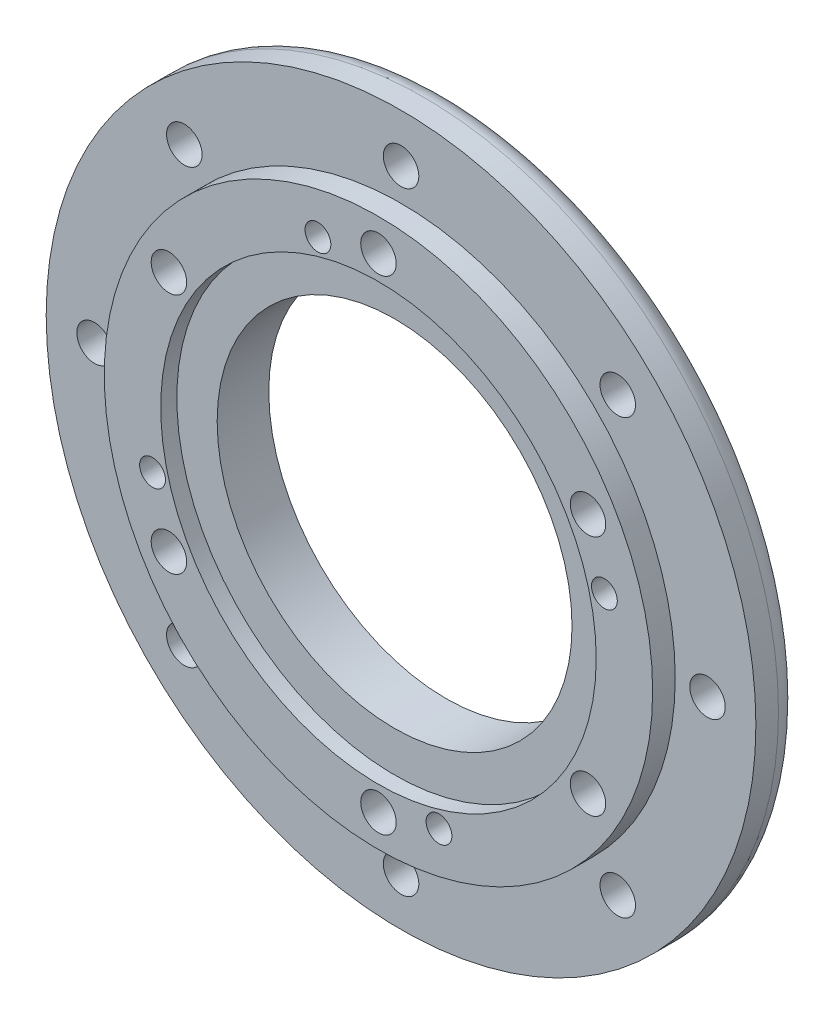
from build123d import *

# Parameters (mm, degrees)
SKETCH_1_R          = 110
EXTRUDE_1_DEPTH     = 14
SKETCH_2_R          = 85
EXTRUDE_2_DEPTH     = 7
SKETCH_3_R          = 55
CUT_EXTRUDE_1_DEPTH = 157.974520225
FILLET_1_R          = 7
SKETCH_5_R          = 5.5
CUT_EXTRUDE_2_DEPTH = 157.974520225
SKETCH_6_R          = 5.5
CUT_EXTRUDE_3_DEPTH = 157.974520225
SKETCH_7_R          = 67.5
CUT_EXTRUDE_4_DEPTH = 5
SKETCH_8_R          = 9
CUT_EXTRUDE_5_DEPTH = 11
SKETCH_10_R         = 4
CUT_EXTRUDE_6_DEPTH = 157.974520225


with BuildPart() as part:
    # 草图1 → 拉伸1 (new body)
    with BuildSketch(Plane.XY):
        Circle(SKETCH_1_R)
    extrude(amount=EXTRUDE_1_DEPTH)

    # 草图2 → 拉伸2 (add)
    with BuildSketch(Plane.XY.offset(14)):
        Circle(SKETCH_2_R)
    extrude(amount=EXTRUDE_2_DEPTH)

    # 草图3 → 切除-拉伸1 (cut, through all)
    with BuildSketch(Plane(origin=(0, 0, 0), x_dir=(-1, 0, 0), z_dir=(0, 0, -1))):
        Circle(SKETCH_3_R)
    extrude(amount=-CUT_EXTRUDE_1_DEPTH, mode=Mode.SUBTRACT)

    # 圆角1
    fillet_1_edges = [part.edges().sort_by_distance(p)[0] for p in [
        (-110, 0, 0),
    ]]
    fillet(fillet_1_edges, radius=FILLET_1_R)

    # 草图5 → 切除-拉伸2 (cut, through all)
    with BuildSketch(Plane(origin=(0, 0, 0), x_dir=(-1, 0, 0), z_dir=(0, 0, -1))):
        with Locations((0, 95)):
            Circle(SKETCH_5_R)
        with Locations((67.175144213, 67.175144213)):
            Circle(SKETCH_5_R)
        with Locations((95, 0)):
            Circle(SKETCH_5_R)
        with Locations((67.175144213, -67.175144213)):
            Circle(SKETCH_5_R)
        with Locations((0, -95)):
            Circle(SKETCH_5_R)
        with Locations((-67.175144213, -67.175144213)):
            Circle(SKETCH_5_R)
        with Locations((-95, 0)):
            Circle(SKETCH_5_R)
        with Locations((-67.175144213, 67.175144213)):
            Circle(SKETCH_5_R)
    extrude(amount=-CUT_EXTRUDE_2_DEPTH, mode=Mode.SUBTRACT)

    # 草图6 → 切除-拉伸3 (cut, through all)
    with BuildSketch(Plane(origin=(0, 0, 0), x_dir=(-1, 0, 0), z_dir=(0, 0, -1))):
        with Locations((0, 75)):
            Circle(SKETCH_6_R)
        with Locations((64.951905284, 37.5)):
            Circle(SKETCH_6_R)
        with Locations((64.951905284, -37.5)):
            Circle(SKETCH_6_R)
        with Locations((0, -75)):
            Circle(SKETCH_6_R)
        with Locations((-64.951905284, -37.5)):
            Circle(SKETCH_6_R)
        with Locations((-64.951905284, 37.5)):
            Circle(SKETCH_6_R)
    extrude(amount=-CUT_EXTRUDE_3_DEPTH, mode=Mode.SUBTRACT)

    # 草图7 → 切除-拉伸4 (cut)
    with BuildSketch(Plane.XY.offset(21)):
        Circle(SKETCH_7_R)
    extrude(amount=-CUT_EXTRUDE_4_DEPTH, mode=Mode.SUBTRACT)

    # 草图8 → 切除-拉伸5 (cut)
    with BuildSketch(Plane(origin=(0, 0, 0), x_dir=(-1, 0, 0), z_dir=(0, 0, -1))):
        with Locations((0, 75)):
            Circle(SKETCH_8_R)
        with Locations((64.951905284, 37.5)):
            Circle(SKETCH_8_R)
        with Locations((64.951905284, -37.5)):
            Circle(SKETCH_8_R)
        with Locations((0, -75)):
            Circle(SKETCH_8_R)
        with Locations((-64.951905284, -37.5)):
            Circle(SKETCH_8_R)
        with Locations((-64.951905284, 37.5)):
            Circle(SKETCH_8_R)
    extrude(amount=-CUT_EXTRUDE_5_DEPTH, mode=Mode.SUBTRACT)

    # 草图10 → 切除-拉伸6 (cut, through all)
    with BuildSketch(Plane(origin=(0, 0, 0), x_dir=(-1, 0, 0), z_dir=(0, 0, -1))):
        with Locations((18.76438077, 70.029622406)):
            Circle(SKETCH_10_R)
        with Locations((70.029622406, -18.76438077)):
            Circle(SKETCH_10_R)
        with Locations((-18.76438077, -70.029622406)):
            Circle(SKETCH_10_R)
        with Locations((-70.029622406, 18.76438077)):
            Circle(SKETCH_10_R)
    extrude(amount=-CUT_EXTRUDE_6_DEPTH, mode=Mode.SUBTRACT)


solid = part.part
